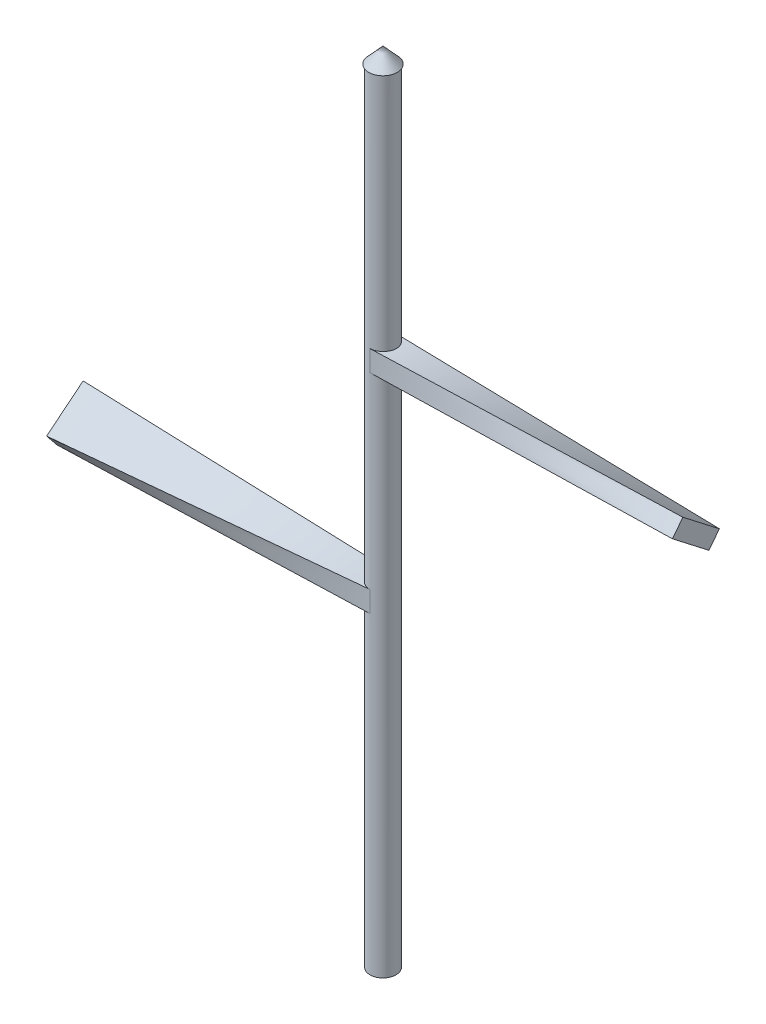
from build123d import *

# Parameters (mm, degrees)
SKETCH1_R           = 2.5
BOSS_EXTRUDE1_DEPTH = 150
CUT_EXTRUDE1_DEPTH  = 10


with BuildPart() as part:
    # Sketch1 → Boss-Extrude1 (new body)
    with BuildSketch(Plane(origin=(0, 0, 0), x_dir=(1, 0, 0), z_dir=(0, 1, 0))):
        with Locations(Location((0, 0, 0), (0, 0, 270))):
            Circle(SKETCH1_R)
    extrude(amount=BOSS_EXTRUDE1_DEPTH)

    # Sketch5 → Revolve9 (revolve)
    with BuildSketch(Plane(origin=(0, 0, 0), x_dir=(0, 0, -1), z_dir=(1, 0, 0)), mode=Mode.PRIVATE) as revolve9_sk:
        Polygon((-2.75, 150), (0, 150), (0, 153), align=None)
    revolve(revolve9_sk.sketch.rotate(Axis((0, 150, 0), (0, -1, 0)), 180), axis=Axis((0, 150, 0), (0, -1, 0)))

    # Sketch17 → Cut-Extrude1 (cut)
    with BuildSketch(Plane.XZ):
        with BuildLine():
            Line((-2.43587323, 0.605492864), (-1.326757825, -2.130683851))
            ThreePointArc((-1.326757825, -2.130683851), (-2.326158608, -0.94291364), (-2.43587323, 0.605492864))
        make_face()
    extrude(amount=-CUT_EXTRUDE1_DEPTH, mode=Mode.SUBTRACT)

    # Sketch18 → Loft1 section 0
    with BuildSketch(Plane(origin=(0, 0, 0), x_dir=(0, 0, -1), z_dir=(1, 0, 0))):
        with BuildLine():
            Line((2.5, 60), (-2.5, 60))
            Line((-2.5, 60), (-2.5, 64))
            Line((-2.5, 64), (2.5, 64))
            Line((2.5, 64), (2.5, 60))
        make_face()
    # Sketch19 → Loft1 section 1
    with BuildSketch(Plane(origin=(-60, 0, 0), x_dir=(0, 0, -1), z_dir=(1, 0, 0))):
        with BuildLine():
            Line((4.5, 63.668014387), (-2.5, 58))
            Line((-2.5, 58), (-4.5, 60.470000787))
            Line((-4.5, 60.470000787), (2.5, 66.138015175))
            Line((2.5, 66.138015175), (4.5, 63.668014387))
        make_face()
    loft()

    # Sketch20 → Loft2 section 0
    with BuildSketch(Plane(origin=(0, 0, 0), x_dir=(0, 0, -1), z_dir=(1, 0, 0))):
        with BuildLine():
            Line((2.5, 100), (-2.5, 100))
            Line((-2.5, 100), (-2.5, 104))
            Line((-2.5, 104), (2.5, 104))
            Line((2.5, 104), (2.5, 100))
        make_face()
    # Sketch21 → Loft2 section 1
    with BuildSketch(Plane(origin=(60, 0, 0), x_dir=(0, 0, -1), z_dir=(1, 0, 0))):
        with BuildLine():
            Line((-2.5, 106), (-4.5, 103.414213562))
            Line((-4.5, 103.414213562), (2.5, 98))
            Line((2.5, 98), (4.5, 100.585786438))
            Line((4.5, 100.585786438), (-2.5, 106))
        make_face()
    loft()


solid = part.part
